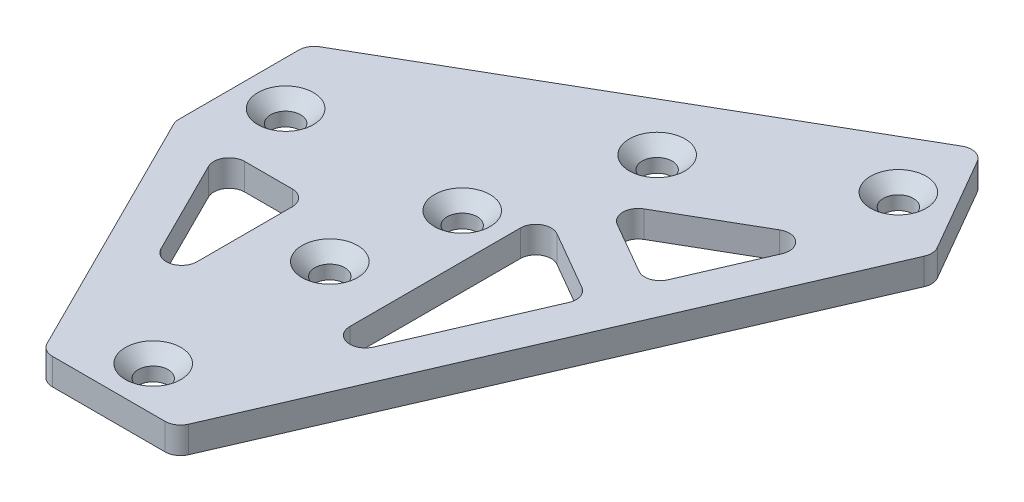
from build123d import *

# Parameters (mm, degrees)
SKETCH_4_R                   = 1.6
EXTRUDE_1_DEPTH              = 1.5
CUT_EXTRUDE_2_DEPTH          = 3
FILLET_2_R                   = 1.75
HOLE_WIZARD_M3_1_D           = 3.4
HOLE_WIZARD_M3_1_DEPTH       = 5.978536948
HOLE_WIZARD_M3_1_CSINK_D     = 6.3
HOLE_WIZARD_M3_1_CSINK_ANGLE = 90
HOLE_WIZARD_M3_1_TIP         = 1.021463052


with BuildPart() as part:
    # ｽｹｯﾁ4 → ﾎﾞｽ - 押し出し1 (new, symmetric)
    with BuildSketch(Plane(origin=(0, 0, 0), x_dir=(1, 0, 0), z_dir=(0, 1, 0))):
        Polygon((-30, 0), (-30, 15), (18.480762114, 42.990381057), (25.980762114, 30), (0, -30), (-15, -30), align=None)
        with Locations(Location((0.580127019, 23.995190528, 0), (0, 0, 270))):
            Circle(SKETCH_4_R, mode=Mode.SUBTRACT)
        with Locations(Location((-5, 7.5, 0), (0, 0, 270))):
            Circle(SKETCH_4_R, mode=Mode.SUBTRACT)
        with Locations(Location((-7.5, -5, 0), (0, 0, 270))):
            Circle(SKETCH_4_R, mode=Mode.SUBTRACT)
        with Locations(Location((-7.5, -25, 0), (0, 0, 270))):
            Circle(SKETCH_4_R, mode=Mode.SUBTRACT)
        with Locations(Location((-25, 7.5, 0), (0, 0, 270))):
            Circle(SKETCH_4_R, mode=Mode.SUBTRACT)
        with Locations(Location((17.900635095, 33.995190528, 0), (0, 0, 270))):
            Circle(SKETCH_4_R, mode=Mode.SUBTRACT)
    extrude(amount=EXTRUDE_1_DEPTH, both=True)

    # ｽｹｯﾁ5 → ｶｯﾄ - 押し出し2 (cut)
    with BuildSketch(Plane(origin=(0, 1.5, 0), x_dir=(1, 0, 0), z_dir=(0, 1, 0))):
        Polygon((12.665448219, 10.574351407), (19.442413698, 26.225082782), (6.92820323, 19), (4.714101615, 15.165063509), align=None)
        Polygon((4.714101615, 15.165063509), (6.92820323, 19), (2.5, 16.443375673), align=None)
        Polygon((2.214101615, 10.834936491), (0, 12.113248654), (0, 7), align=None)
        Polygon((0, 0), (0, -18.675248347), (10.665448219, 5.955549254), (2.214101615, 10.834936491), (0, 7), align=None)
        Polygon((-15, 0), (-24.968847051, 0), (-15, -19.937694101), align=None)
    extrude(amount=-CUT_EXTRUDE_2_DEPTH, mode=Mode.SUBTRACT)

    # ﾌｨﾚｯﾄ2
    fillet_2_edges = [part.edges().sort_by_distance(p)[0] for p in [
        (-30, 0, 0),
        (-30, 0, -15),
        (18.480762114, 0, -42.990381057),
        (25.980762114, 0, -30),
        (0, 0, 30),
        (-15, 0, 30),
        (-24.968847051, 0, 0),
        (-15, 0, 0),
        (-15, 0, 19.937694101),
        (0, 0, 18.675248347),
        (0, 0, -12.113248654),
        (10.665448219, 0, -5.955549254),
        (2.5, 0, -16.443375673),
        (19.442413698, 0, -26.225082782),
        (12.665448219, 0, -10.574351407),
    ]]
    fillet(fillet_2_edges, radius=FILLET_2_R)

    # M3 丸皿ねじ用皿穴1
    with Locations(Plane(origin=(-25, 1.5, -7.5), x_dir=(0, 0, 1), z_dir=(0, 1, 0))):
        with Locations((0, 0), (0, 20), (12.5, 17.5), (32.5, 17.5), (-16.495190528, 25.580127019), (-26.495190528, 42.900635095)):
            CounterSinkHole(HOLE_WIZARD_M3_1_D / 2, HOLE_WIZARD_M3_1_CSINK_D / 2, depth=HOLE_WIZARD_M3_1_DEPTH, counter_sink_angle=HOLE_WIZARD_M3_1_CSINK_ANGLE)
            with Locations((0, 0, -(HOLE_WIZARD_M3_1_DEPTH + HOLE_WIZARD_M3_1_TIP / 2))):  # 118° drill point
                Cone(0, HOLE_WIZARD_M3_1_D / 2, HOLE_WIZARD_M3_1_TIP, mode=Mode.SUBTRACT)


solid = part.part
